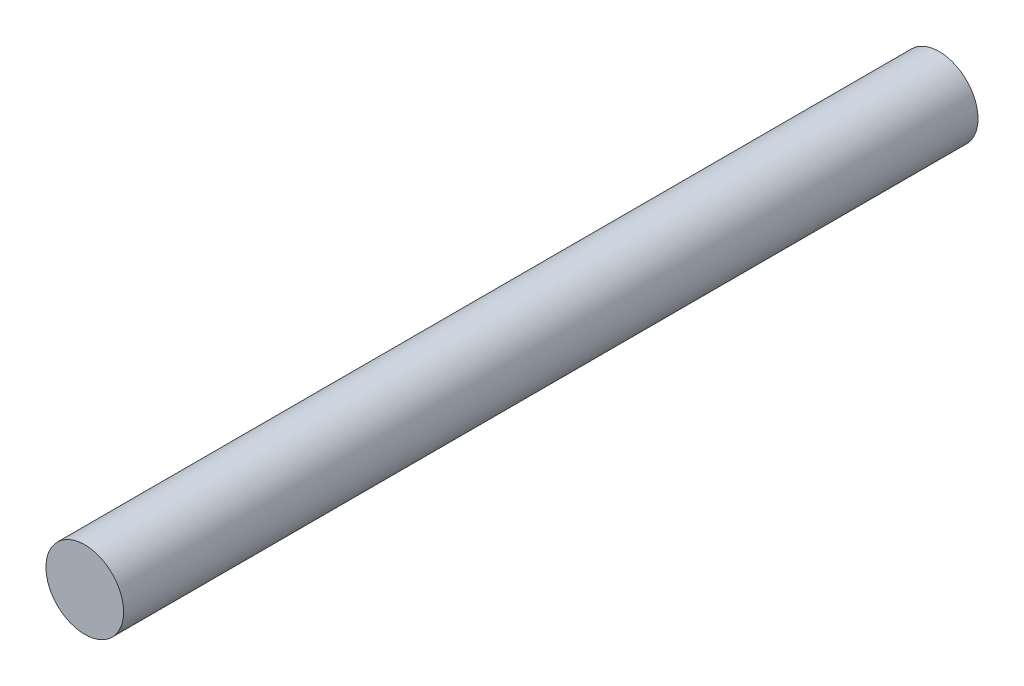
from build123d import *

# Parameters (mm, degrees)
SKETCH1_R           = 4
BOSS_EXTRUDE1_DEPTH = 88


with BuildPart() as part:
    # Sketch1 → Boss-Extrude1 (new body)
    with BuildSketch(Plane.XY):
        Circle(SKETCH1_R)
    extrude(amount=BOSS_EXTRUDE1_DEPTH)


solid = part.part
